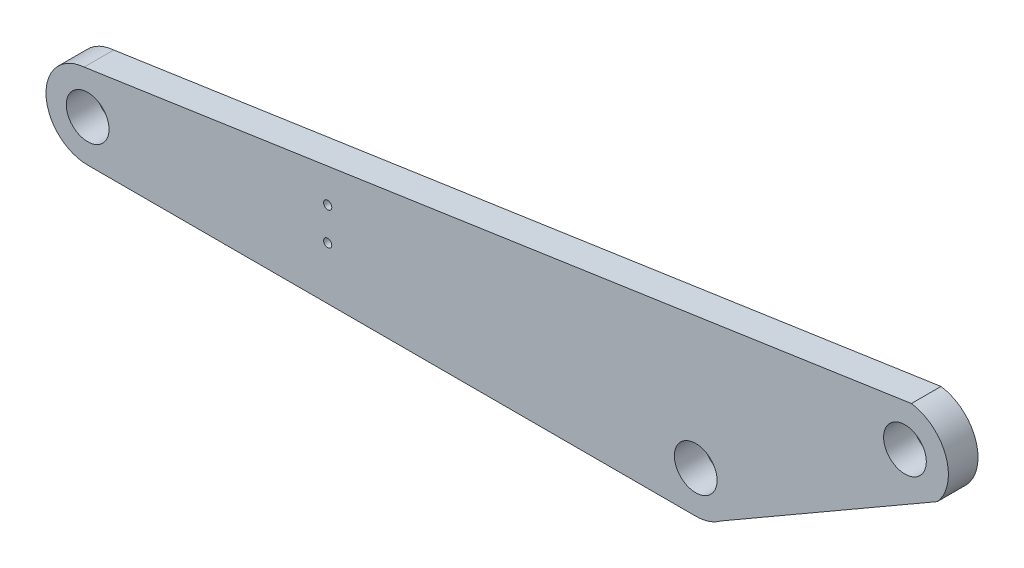
from build123d import *

# Parameters (mm, degrees)
ESQUISSE1_R        = 13
ESQUISSE1_R_2      = 2.5
BOSS_EXTRU_1_DEPTH = 18


with BuildPart() as part:
    # Esquisse1 → Boss.-Extru.1 (new body)
    with BuildSketch(Plane.XY):
        with BuildLine():
            Line((131.250734203, 99.6547201), (-372.143084144, 25.254923169))
            ThreePointArc((-372.143084144, 25.254923169), (-395.317180347, -1.201804157), (-369.741140617, -25.344367141))
            Line((-369.741140617, -25.344367141), (-0.588044699, -25.344367141))
            ThreePointArc((-0.588044699, -25.344367141), (7.767914285, -24.13176848), (15.262182774, -20.242245906))
            Line((15.262182774, -20.242245906), (146.950608566, 55.788102175))
            ThreePointArc((146.950608566, 55.788102175), (152.209360228, 82.413014403), (131.250734203, 99.6547201))
        make_face()
        with Locations((-370, 0)):
            Circle(ESQUISSE1_R, mode=Mode.SUBTRACT)
        with Locations((127.305734356, 73.5)):
            Circle(ESQUISSE1_R, mode=Mode.SUBTRACT)
        Circle(ESQUISSE1_R, mode=Mode.SUBTRACT)
        with Locations((-223.959522936, 6.655632859)):
            Circle(ESQUISSE1_R_2, mode=Mode.SUBTRACT)
        with Locations((-223.959522936, 26.655632859)):
            Circle(ESQUISSE1_R_2, mode=Mode.SUBTRACT)
    extrude(amount=BOSS_EXTRU_1_DEPTH)


solid = part.part
